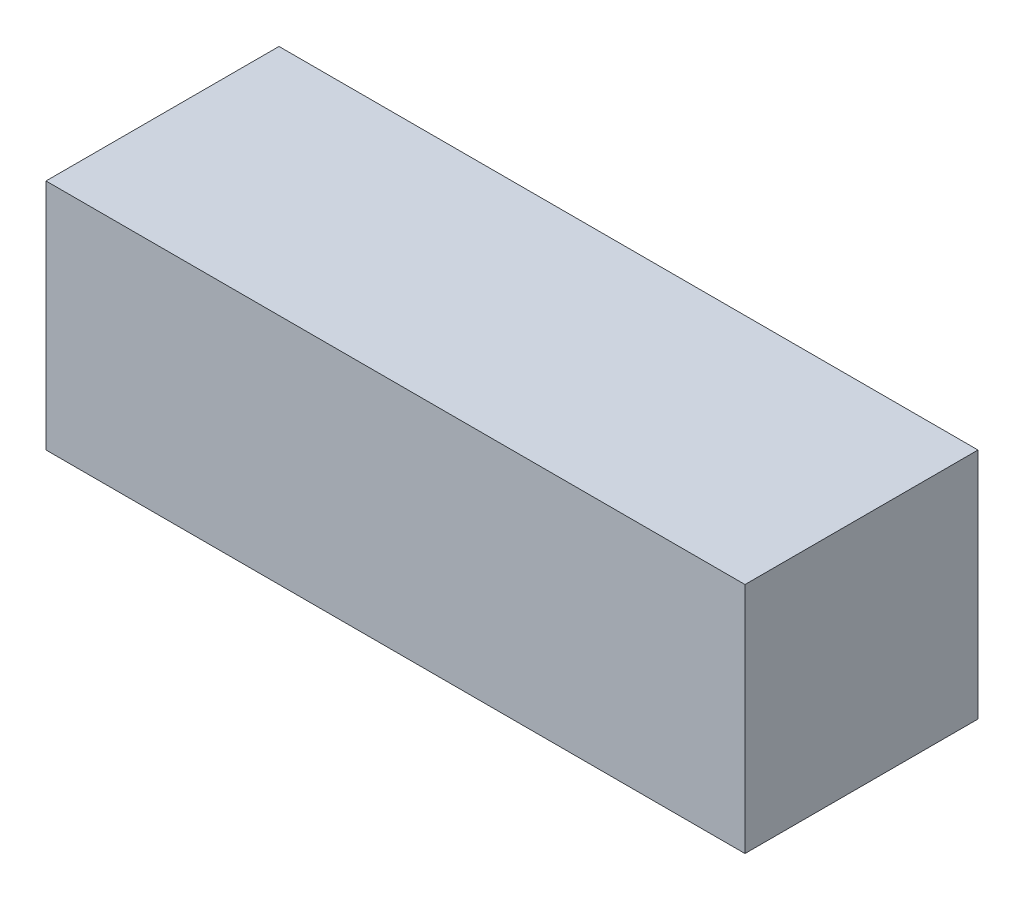
from build123d import *

# Parameters (mm, degrees)
SKETCH1_W           = 4
SKETCH1_H           = 4
BOSS_EXTRUDE1_DEPTH = 6


with BuildPart() as part:
    # Sketch1 → Boss-Extrude1 (new, symmetric)
    with BuildSketch(Plane(origin=(0, 0, 0), x_dir=(0, 0, -1), z_dir=(1, 0, 0))):
        Rectangle(SKETCH1_W, SKETCH1_H)
    extrude(amount=BOSS_EXTRUDE1_DEPTH, both=True)


solid = part.part
